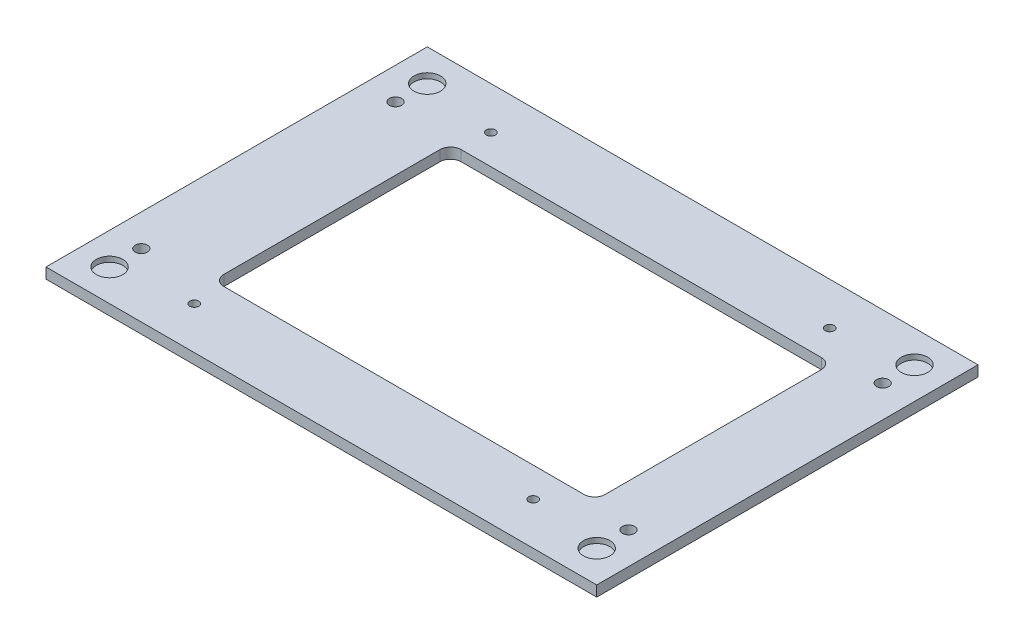
from build123d import *

# Parameters (mm, degrees)
SKETCH1_W                       = 165.1
SKETCH1_H                       = 114.3
BOSS_EXTRUDE1_DEPTH             = 3.175
SKETCH3_R                       = 3.96875
CUT_EXTRUDE2_DEPTH              = 1.5875
F_6_32_TAPPED_HOLE1_D           = 2.7051
SKETCH11_W                      = 107.95
SKETCH11_H                      = 71.12
SKETCH11_W_2                    = 6.35
CUT_EXTRUDE3_DEPTH              = 101.452504324
FILLET1_R                       = 3.175
F_27_0_144_DIAMETER_HOLE1_D     = 3.6576
F_27_0_144_DIAMETER_HOLE1_DEPTH = 3.302
F_27_0_144_DIAMETER_HOLE1_TIP   = 1.0988539


with BuildPart() as part:
    # Sketch1 → Boss-Extrude1 (new body)
    with BuildSketch(Plane(origin=(0, 0, 0), x_dir=(1, 0, 0), z_dir=(0, 1, 0))):
        Rectangle(SKETCH1_W, SKETCH1_H)
    extrude(amount=BOSS_EXTRUDE1_DEPTH)

    # Sketch3 → Cut-Extrude2 (cut)
    with BuildSketch(Plane(origin=(0, 3.175, 0), x_dir=(1, 0, 0), z_dir=(0, 1, 0))):
        with Locations(Location((-73.025, 47.625, 0), (0, 0, 270))):
            Circle(SKETCH3_R)
        with Locations(Location((-73.025, -47.625, 0), (0, 0, 270))):
            Circle(SKETCH3_R)
        with Locations(Location((73.025, 47.625, 0), (0, 0, 270))):
            Circle(SKETCH3_R)
        with Locations(Location((73.025, -47.625, 0), (0, 0, 270))):
            Circle(SKETCH3_R)
    extrude(amount=-CUT_EXTRUDE2_DEPTH, mode=Mode.SUBTRACT)

    # #6-32 Tapped Hole1 (through all)
    with Locations(Plane(origin=(0, 3.175, 0), x_dir=(-1, 0, 0), z_dir=(0, 1, 0))):
        with Locations((50.8, -44.45), (-50.8, -44.45), (-50.8, 44.45), (50.8, 44.45)):
            Hole(F_6_32_TAPPED_HOLE1_D / 2)

    # Sketch11 → Cut-Extrude3 (cut, through all)
    with BuildSketch(Plane(origin=(0, 3.175, 0), x_dir=(1, 0, 0), z_dir=(0, 1, 0))):
        Rectangle(SKETCH11_W, SKETCH11_H)
        with Locations((57.15, 0)):
            Rectangle(SKETCH11_W_2, SKETCH11_H)
    extrude(amount=-CUT_EXTRUDE3_DEPTH, mode=Mode.SUBTRACT)

    # Fillet1
    fillet1_edges = [part.edges().sort_by_distance(p)[0] for p in [
        (60.325, 1.5875, 35.56),
        (-53.975, 1.5875, 35.56),
        (-53.975, 1.5875, -35.56),
        (60.325, 1.5875, -35.56),
    ]]
    fillet(fillet1_edges, radius=FILLET1_R)

    # #27 (0.144) Diameter Hole1
    with Locations(Plane(origin=(0, 3.175, 0), x_dir=(-1, 0, 0), z_dir=(0, 1, 0))):
        with Locations((73.025, -38.1), (73.025, 38.1), (-73.025, -38.1), (-73.025, 38.1)):
            Hole(F_27_0_144_DIAMETER_HOLE1_D / 2, depth=F_27_0_144_DIAMETER_HOLE1_DEPTH)
            with Locations((0, 0, -(F_27_0_144_DIAMETER_HOLE1_DEPTH + F_27_0_144_DIAMETER_HOLE1_TIP / 2))):  # 118° drill point
                Cone(0, F_27_0_144_DIAMETER_HOLE1_D / 2, F_27_0_144_DIAMETER_HOLE1_TIP, mode=Mode.SUBTRACT)


solid = part.part
